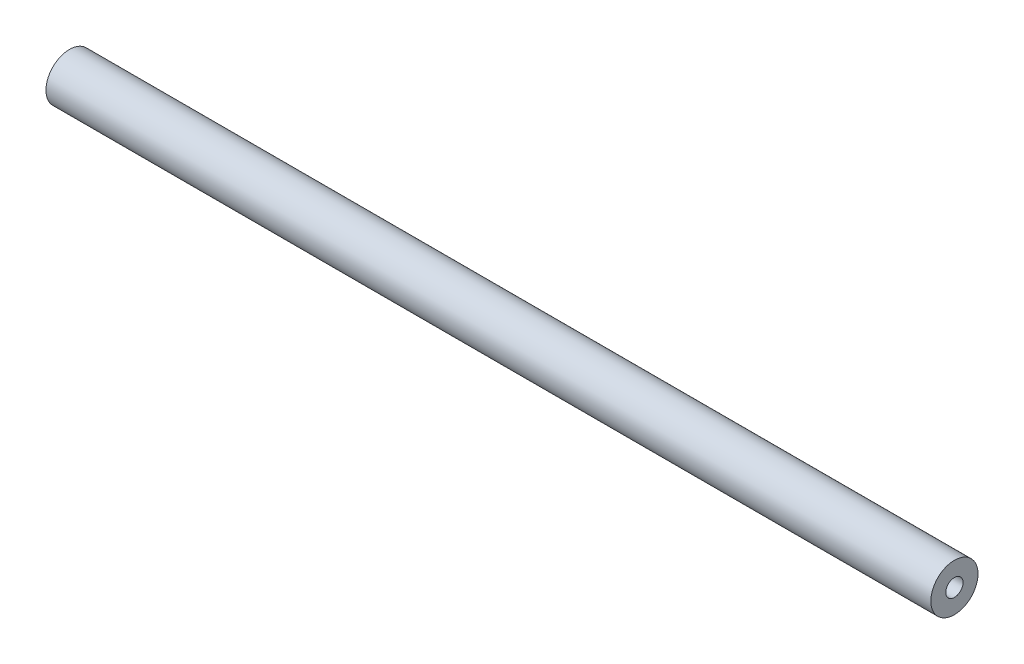
from build123d import *

# Parameters (mm, degrees)
SKETCH_1_R      = 4.5
SKETCH_1_R_2    = 1.65
EXTRUDE_1_DEPTH = 168.9


with BuildPart() as part:
    # 草图1 → 凸台-拉伸1 (new body)
    with BuildSketch(Plane(origin=(0, 0, 0), x_dir=(0, 0, -1), z_dir=(1, 0, 0))):
        Circle(SKETCH_1_R)
        Circle(SKETCH_1_R_2, mode=Mode.SUBTRACT)
    extrude(amount=EXTRUDE_1_DEPTH)


solid = part.part
